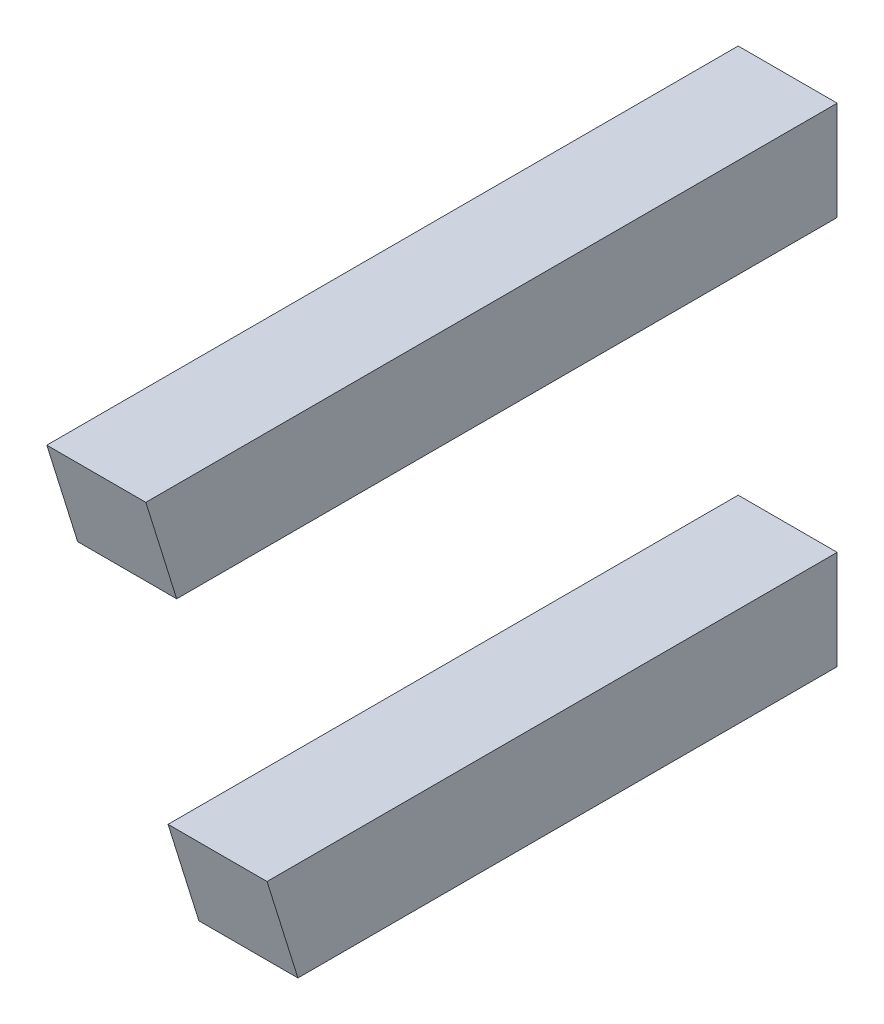
from build123d import *

# Parameters (mm, degrees)
SKETCH1_W               = 2.8
SKETCH1_H               = 2.8
BOSS_EXTRUDE1_DEPTH     = 20
BOSS_EXTRUDE1_2_DEPTH   = 20
CUT_EXTRUDE1_DEPTH      = 25.459762877
CUT_EXTRUDE1_DEPTH_BACK = 25.459762877
CHAMFER1_SIZE           = 0.25
CHAMFER2_SIZE           = 0.25


with BuildPart() as part:
    # Sketch1 → Boss-Extrude1 (new body)
    with BuildSketch(Plane.XY):
        with Locations((1.4, 12.4)):
            Rectangle(SKETCH1_W, SKETCH1_H)
    extrude(amount=-BOSS_EXTRUDE1_DEPTH)


with BuildPart() as body_2:
    # Sketch1 → Boss-Extrude1 2 (new body)
    with BuildSketch(Plane.XY):
        with Locations((1.4, 1.4)):
            Rectangle(SKETCH1_W, SKETCH1_H)
    extrude(amount=-BOSS_EXTRUDE1_2_DEPTH)


with BuildPart() as cut_extrude1_tool:
    # Sketch2 → Cut-Extrude1 (new, two sides: drawn at the far end of the back side and taken through both)
    with BuildSketch(Plane(origin=(2.8, 0, 0), x_dir=(0, 0, -1), z_dir=(1, 0, 0)).offset(-CUT_EXTRUDE1_DEPTH_BACK)):
        Polygon((0, 2.8), (3.627360986, 2.8), (-1.733135817, 20), (-2.733135817, 20), (-2.733135817, 0), (0, 0), align=None)
        Polygon((5.123313582, -2), (4.5, 0), (0, 0), (-2.733135817, 0), (-2.733135817, -2), align=None)
        Polygon((0, 0), (4.5, 0), (3.627360986, 2.8), (0, 2.8), align=None)
    extrude(amount=CUT_EXTRUDE1_DEPTH + CUT_EXTRUDE1_DEPTH_BACK)


with BuildPart() as part_1:
    add(part.part)

    # Cut-Extrude1: cut by cut_extrude1_tool
    add(cut_extrude1_tool.part, mode=Mode.SUBTRACT)

    # Chamfer2
    chamfer2_edges = [part_1.edges().sort_by_distance(p)[0] for p in [
        (2.8, 12.4, -20),
        (1.4, 13.8, -20),
        (0, 12.4, -20),
        (1.4, 11, -20),
    ]]
    chamfer(chamfer2_edges, length=CHAMFER2_SIZE)


with BuildPart() as body_2_1:
    add(body_2.part)

    # Cut-Extrude1: cut by cut_extrude1_tool
    add(cut_extrude1_tool.part, mode=Mode.SUBTRACT)

    # Chamfer1
    chamfer1_edges = [body_2_1.edges().sort_by_distance(p)[0] for p in [
        (1.4, 2.8, -20),
        (0, 1.4, -20),
        (1.4, 0, -20),
        (2.8, 1.4, -20),
    ]]
    chamfer(chamfer1_edges, length=CHAMFER1_SIZE)


solid = Compound([part_1.part, body_2_1.part])
